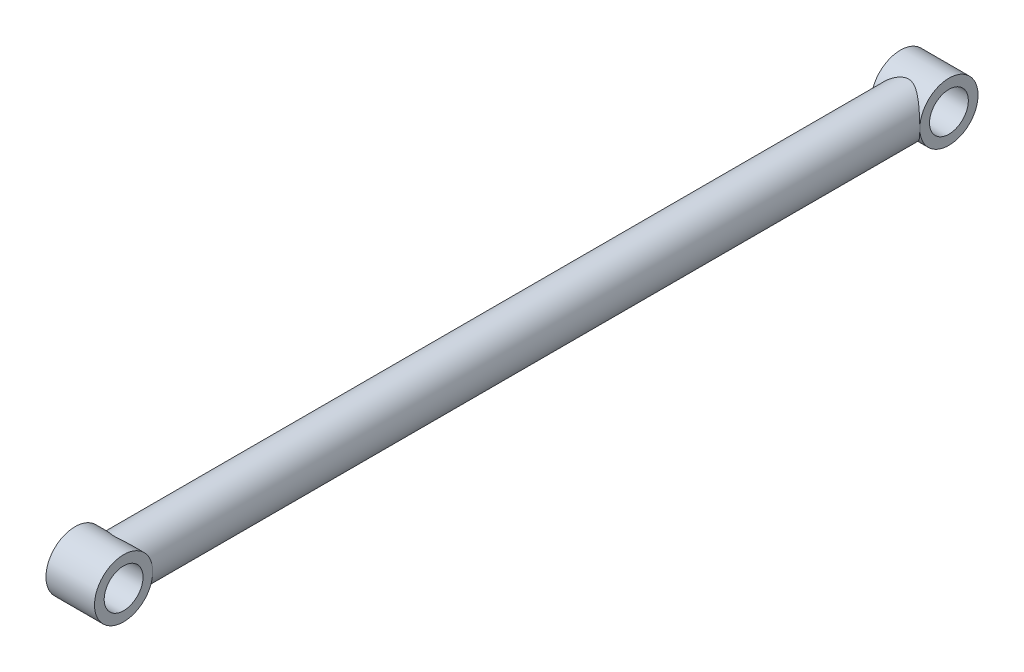
from build123d import *

# Parameters (mm, degrees)
SKETCH3_R           = 5
BOSS_EXTRUDE1_DEPTH = 170
SKETCH4_R           = 6
BOSS_EXTRUDE2_DEPTH = 5
SKETCH5_R           = 4
SKETCH5_R_2         = 3.999944286
CUT_EXTRUDE1_DEPTH  = 12


with BuildPart() as part:
    # Sketch3 → Boss-Extrude1 (new body)
    with BuildSketch(Plane.XY):
        Circle(SKETCH3_R)
    extrude(amount=BOSS_EXTRUDE1_DEPTH)

    # Sketch4 → Boss-Extrude2 (add, symmetric)
    with BuildSketch(Plane(origin=(0, 0, 0), x_dir=(0, 0, -1), z_dir=(1, 0, 0))):
        with Locations((-170, 0)):
            Circle(SKETCH4_R)
        Circle(SKETCH4_R)
    extrude(amount=BOSS_EXTRUDE2_DEPTH, both=True)

    # Sketch5 → Cut-Extrude1 (cut)
    with BuildSketch(Plane(origin=(5, 0, 0), x_dir=(0, 0, -1), z_dir=(1, 0, 0))):
        with Locations((-170, 0)):
            Circle(SKETCH5_R)
        Circle(SKETCH5_R_2)
    extrude(amount=-CUT_EXTRUDE1_DEPTH, mode=Mode.SUBTRACT)


solid = part.part
